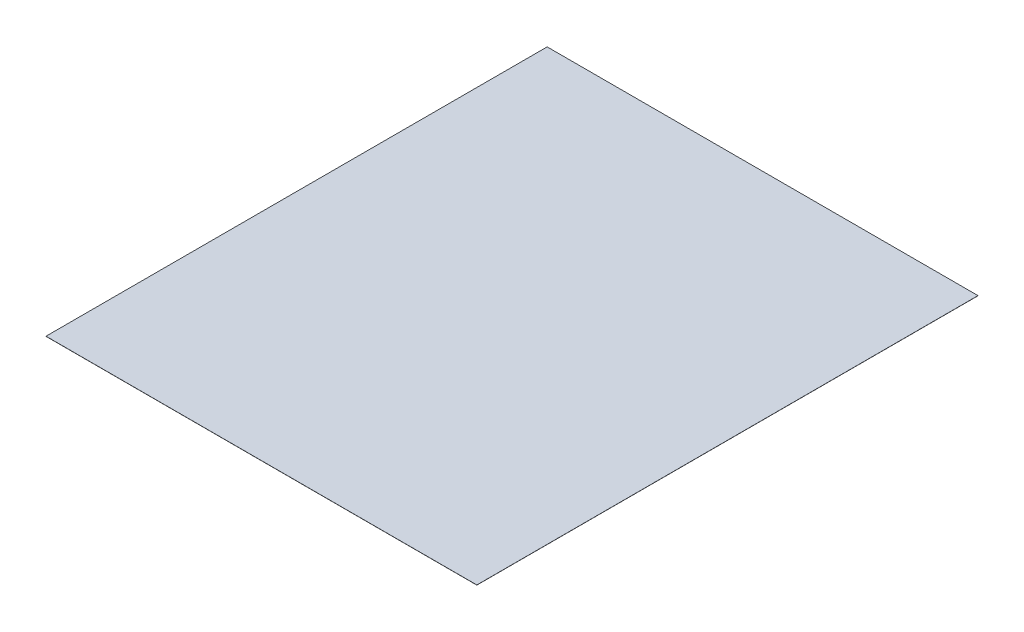
from build123d import *

# Parameters (mm, degrees)
SKETCH1_W           = 7315.2
SKETCH1_H           = 8509
BOSS_EXTRUDE1_DEPTH = 2.54


with BuildPart() as part:
    # Sketch1 → Boss-Extrude1 (new body)
    with BuildSketch(Plane(origin=(0, 0, 0), x_dir=(1, 0, 0), z_dir=(0, 1, 0))):
        with Locations((3657.6, 4254.5)):
            Rectangle(SKETCH1_W, SKETCH1_H)
    extrude(amount=BOSS_EXTRUDE1_DEPTH)


solid = part.part
